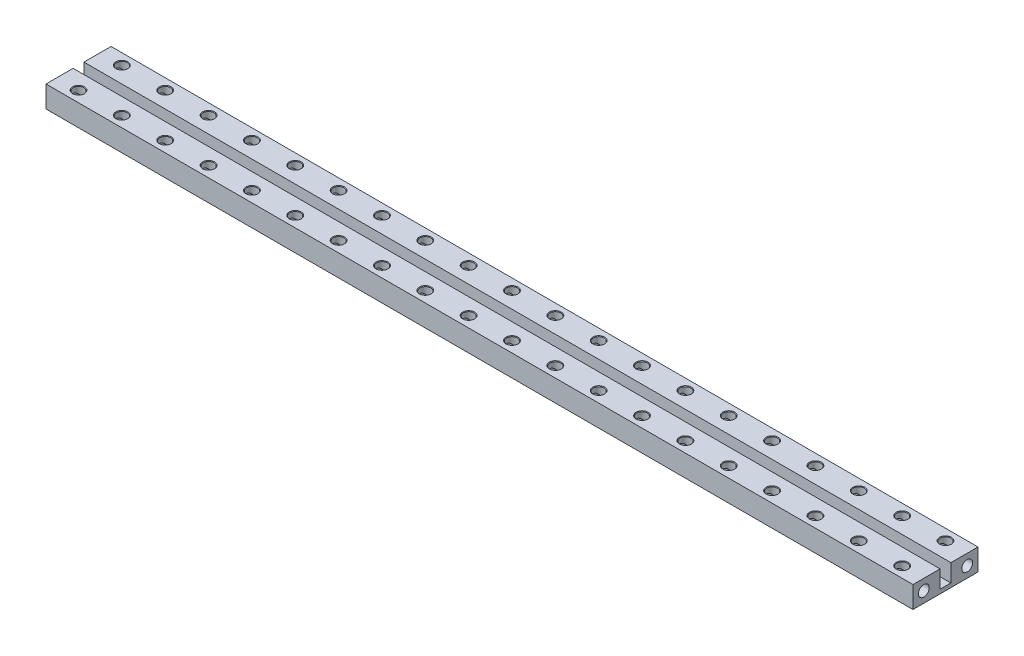
from build123d import *

# Parameters (mm, degrees)
EXTRUDE_1_DEPTH     = 320
SKETCH_2_R          = 2
CUT_EXTRUDE_1_DEPTH = 320
CHAMFER_1_SIZE      = 0.2
SKETCH_3_R          = 2
CUT_EXTRUDE_2_DEPTH = 321.998442364


with BuildPart() as part:
    # 草图1 → 凸台-拉伸1 (new body)
    with BuildSketch(Plane(origin=(0, 0, 0), x_dir=(0, 0, -1), z_dir=(1, 0, 0))):
        Polygon((14, 8), (24, 8), (24, 0), (0, 0), (0, 8), (10, 8), (10, 1.5), (14, 1.5), align=None)
    extrude(amount=EXTRUDE_1_DEPTH)

    # 草图2 → 切除-拉伸1 (cut)
    with BuildSketch(Plane(origin=(0, 8, 0), x_dir=(1, 0, 0), z_dir=(0, 1, 0))):
        with Locations(Location((8, 4, 0), (0, 0, 270))):
            Circle(SKETCH_2_R)
        with Locations(Location((8, 20, 0), (0, 0, 270))):
            Circle(SKETCH_2_R)
        with Locations(Location((24, 20, 0), (0, 0, 270))):
            Circle(SKETCH_2_R)
        with Locations(Location((24, 4, 0), (0, 0, 270))):
            Circle(SKETCH_2_R)
        with Locations(Location((40, 20, 0), (0, 0, 270))):
            Circle(SKETCH_2_R)
        with Locations(Location((40, 4, 0), (0, 0, 270))):
            Circle(SKETCH_2_R)
        with Locations(Location((56, 20, 0), (0, 0, 270))):
            Circle(SKETCH_2_R)
        with Locations(Location((56, 4, 0), (0, 0, 270))):
            Circle(SKETCH_2_R)
        with Locations(Location((72, 20, 0), (0, 0, 270))):
            Circle(SKETCH_2_R)
        with Locations(Location((72, 4, 0), (0, 0, 270))):
            Circle(SKETCH_2_R)
        with Locations(Location((88, 20, 0), (0, 0, 270))):
            Circle(SKETCH_2_R)
        with Locations(Location((88, 4, 0), (0, 0, 270))):
            Circle(SKETCH_2_R)
        with Locations(Location((104, 20, 0), (0, 0, 270))):
            Circle(SKETCH_2_R)
        with Locations(Location((104, 4, 0), (0, 0, 270))):
            Circle(SKETCH_2_R)
        with Locations(Location((120, 20, 0), (0, 0, 270))):
            Circle(SKETCH_2_R)
        with Locations(Location((120, 4, 0), (0, 0, 270))):
            Circle(SKETCH_2_R)
        with Locations(Location((136, 20, 0), (0, 0, 270))):
            Circle(SKETCH_2_R)
        with Locations(Location((136, 4, 0), (0, 0, 270))):
            Circle(SKETCH_2_R)
        with Locations(Location((152, 20, 0), (0, 0, 270))):
            Circle(SKETCH_2_R)
        with Locations(Location((152, 4, 0), (0, 0, 270))):
            Circle(SKETCH_2_R)
        with Locations(Location((168, 20, 0), (0, 0, 270))):
            Circle(SKETCH_2_R)
        with Locations(Location((168, 4, 0), (0, 0, 270))):
            Circle(SKETCH_2_R)
        with Locations(Location((184, 20, 0), (0, 0, 270))):
            Circle(SKETCH_2_R)
        with Locations(Location((184, 4, 0), (0, 0, 270))):
            Circle(SKETCH_2_R)
        with Locations(Location((200, 20, 0), (0, 0, 270))):
            Circle(SKETCH_2_R)
        with Locations(Location((200, 4, 0), (0, 0, 270))):
            Circle(SKETCH_2_R)
        with Locations(Location((216, 20, 0), (0, 0, 270))):
            Circle(SKETCH_2_R)
        with Locations(Location((216, 4, 0), (0, 0, 270))):
            Circle(SKETCH_2_R)
        with Locations(Location((232, 20, 0), (0, 0, 270))):
            Circle(SKETCH_2_R)
        with Locations(Location((232, 4, 0), (0, 0, 270))):
            Circle(SKETCH_2_R)
        with Locations(Location((248, 20, 0), (0, 0, 270))):
            Circle(SKETCH_2_R)
        with Locations(Location((248, 4, 0), (0, 0, 270))):
            Circle(SKETCH_2_R)
        with Locations(Location((264, 20, 0), (0, 0, 270))):
            Circle(SKETCH_2_R)
        with Locations(Location((264, 4, 0), (0, 0, 270))):
            Circle(SKETCH_2_R)
        with Locations(Location((280, 20, 0), (0, 0, 270))):
            Circle(SKETCH_2_R)
        with Locations(Location((280, 4, 0), (0, 0, 270))):
            Circle(SKETCH_2_R)
        with Locations(Location((296, 20, 0), (0, 0, 270))):
            Circle(SKETCH_2_R)
        with Locations(Location((296, 4, 0), (0, 0, 270))):
            Circle(SKETCH_2_R)
        with Locations(Location((312, 20, 0), (0, 0, 270))):
            Circle(SKETCH_2_R)
        with Locations(Location((312, 4, 0), (0, 0, 270))):
            Circle(SKETCH_2_R)
    extrude(amount=-CUT_EXTRUDE_1_DEPTH, mode=Mode.SUBTRACT)

    # 倒角1
    chamfer_1_edges = [part.edges().sort_by_distance(p)[0] for p in [
        (216, 0, -22),
        (216, 8, -22),
        (232, 0, -6),
        (232, 8, -6),
        (40, 0, -22),
        (40, 8, -22),
        (56, 0, -6),
        (56, 8, -6),
        (56, 0, -22),
        (56, 8, -22),
        (72, 0, -6),
        (72, 8, -6),
        (8, 0, -22),
        (8, 8, -22),
        (24, 0, -6),
        (24, 8, -6),
        (24, 0, -22),
        (24, 8, -22),
        (40, 0, -6),
        (40, 8, -6),
        (104, 0, -22),
        (104, 8, -22),
        (120, 0, -6),
        (120, 8, -6),
        (120, 0, -22),
        (120, 8, -22),
        (136, 0, -6),
        (136, 8, -6),
        (72, 0, -22),
        (72, 8, -22),
        (88, 0, -6),
        (88, 8, -6),
        (88, 0, -22),
        (88, 8, -22),
        (104, 0, -6),
        (104, 8, -6),
        (296, 0, -22),
        (296, 8, -22),
        (312, 0, -6),
        (312, 8, -6),
        (312, 0, -22),
        (312, 8, -22),
        (264, 0, -22),
        (264, 8, -22),
        (280, 0, -6),
        (280, 8, -6),
        (280, 0, -22),
        (280, 8, -22),
        (296, 0, -6),
        (296, 8, -6),
        (8, 0, -6),
        (8, 8, -6),
        (168, 0, -22),
        (168, 8, -22),
        (184, 0, -6),
        (184, 8, -6),
        (184, 0, -22),
        (184, 8, -22),
        (200, 0, -6),
        (200, 8, -6),
        (136, 0, -22),
        (136, 8, -22),
        (152, 0, -6),
        (152, 8, -6),
        (152, 0, -22),
        (152, 8, -22),
        (168, 0, -6),
        (168, 8, -6),
        (232, 0, -22),
        (232, 8, -22),
        (248, 0, -6),
        (248, 8, -6),
        (248, 0, -22),
        (248, 8, -22),
        (264, 0, -6),
        (264, 8, -6),
        (200, 0, -22),
        (200, 8, -22),
        (216, 0, -6),
        (216, 8, -6),
    ]]
    chamfer(chamfer_1_edges, length=CHAMFER_1_SIZE)

    # 草图3 → 切除-拉伸2 (cut, through all)
    with BuildSketch(Plane.ZY):
        with Locations((-20, 4)):
            Circle(SKETCH_3_R)
        with Locations((-4, 4)):
            Circle(SKETCH_3_R)
    extrude(amount=-CUT_EXTRUDE_2_DEPTH, mode=Mode.SUBTRACT)


solid = part.part
